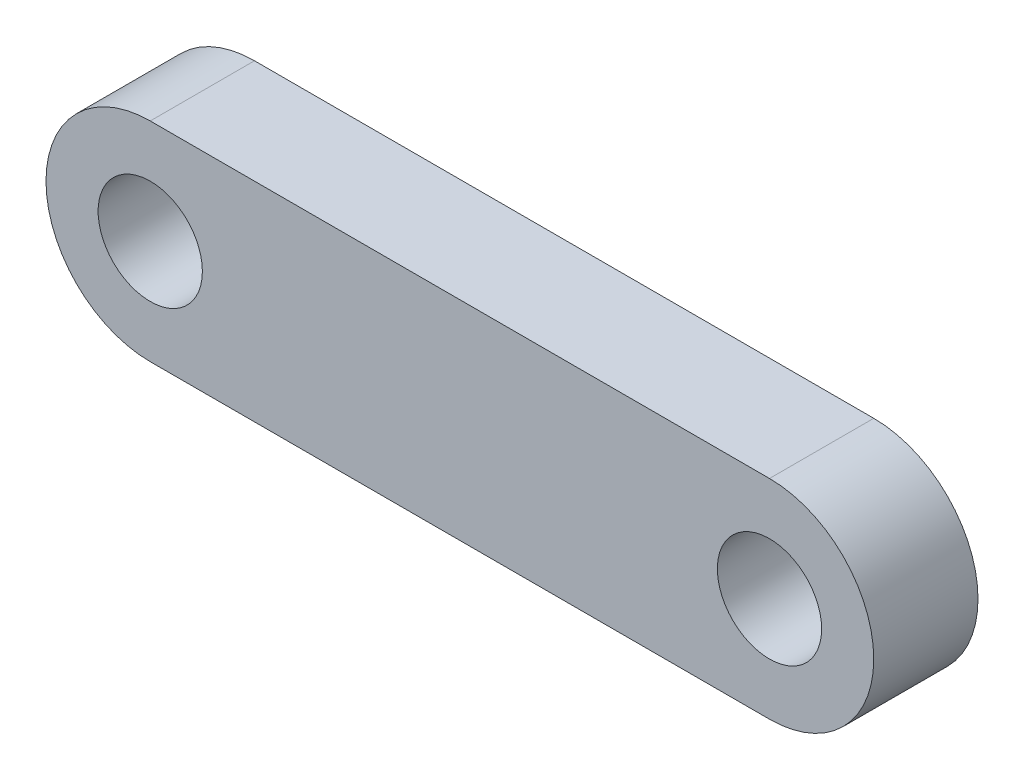
from build123d import *

# Parameters (mm, degrees)
SKETCH_1_R      = 1
EXTRUDE_1_DEPTH = 2


with BuildPart() as part:
    # 草圖1 → 填料-伸長1 (new body)
    with BuildSketch(Plane.XY):
        with BuildLine():
            Line((-5.939999992, 2.000306489), (5.940000008, 2.000306489))
            ThreePointArc((5.940000008, 2.000306489), (7.940000008, 0.000306489), (5.940000008, -1.999693511))
            Line((5.940000008, -1.999693511), (-5.939999992, -1.999693511))
            ThreePointArc((-5.939999992, -1.999693511), (-7.939999992, 0.000306489), (-5.939999992, 2.000306489))
        make_face()
        with Locations((-5.939999992, 0.000306489)):
            Circle(SKETCH_1_R, mode=Mode.SUBTRACT)
        with Locations((5.940000008, 0.000306489)):
            Circle(SKETCH_1_R, mode=Mode.SUBTRACT)
    extrude(amount=EXTRUDE_1_DEPTH)


solid = part.part
